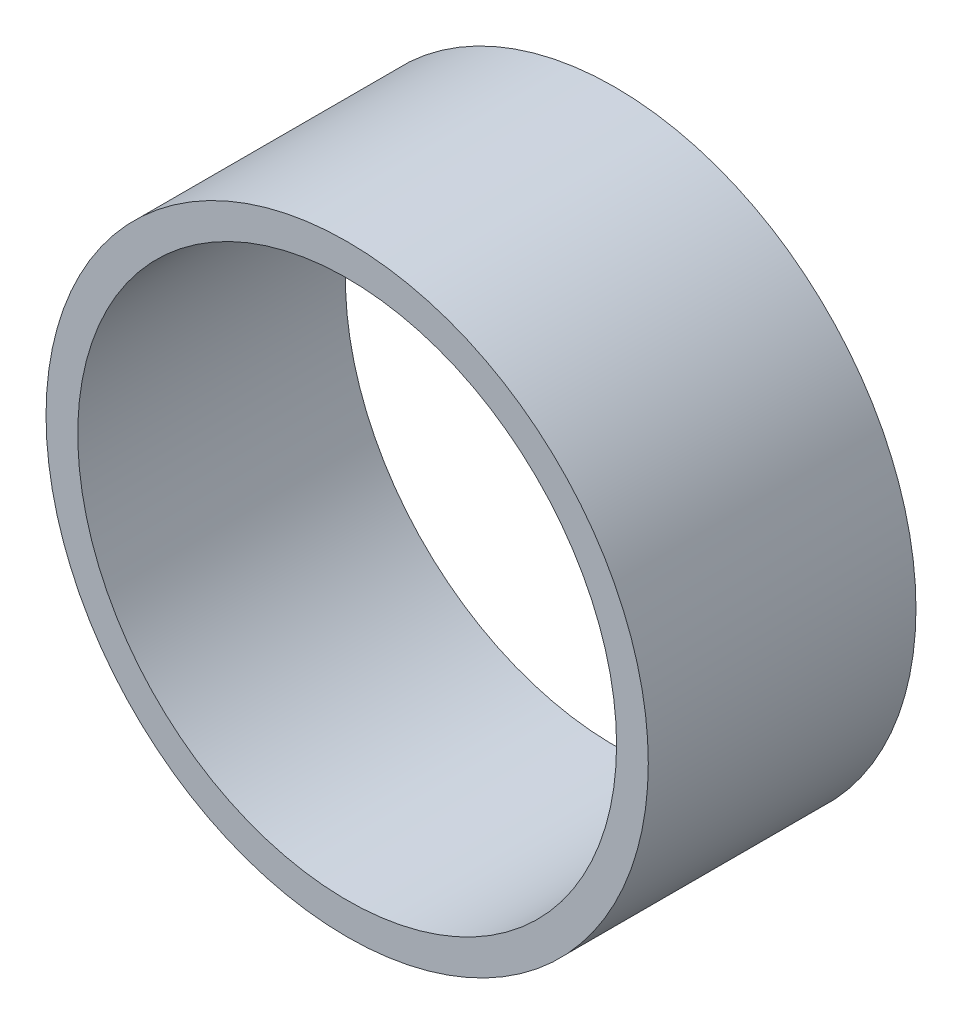
from build123d import *

# Parameters (mm, degrees)
PIPESKETCH_R    = 57.15
PIPESKETCH_R_2  = 51.1302
EXTRUSION_DEPTH = 50.8


with BuildPart() as part:
    # PipeSketch → Extrusion (new body)
    with BuildSketch(Plane.XY):
        Circle(PIPESKETCH_R)
        Circle(PIPESKETCH_R_2, mode=Mode.SUBTRACT)
    extrude(amount=EXTRUSION_DEPTH)


solid = part.part
